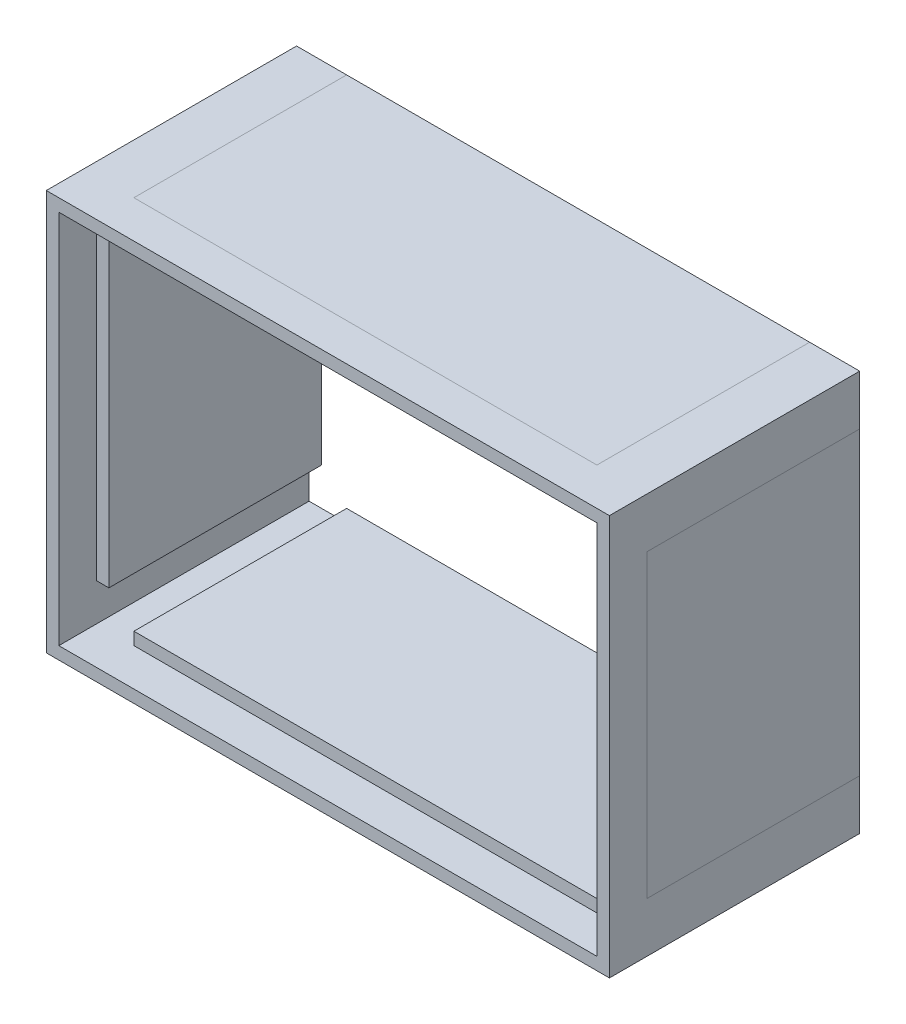
from build123d import *

# Parameters (mm, degrees)
SKETCH1_W               = 4500
SKETCH1_H               = 3200
SKETCH1_W_2             = 4300
SKETCH1_H_2             = 3000
BOSS_EXTRUDE1_DEPTH     = 2000
CUT_EXTRUDE1_DEPTH      = 5819.93461039
CUT_EXTRUDE1_DEPTH_BACK = 5819.93461039
SKETCH2_W               = 3700
SKETCH2_H               = 1700
CUT_EXTRUDE2_DEPTH      = 5873.81874401
CUT_EXTRUDE2_DEPTH_BACK = 5873.81874401
SKETCH3_W               = 1700
SKETCH3_H               = 2400
SKETCH4_W               = 3700
SKETCH4_H               = 200
BOSS_EXTRUDE2_DEPTH     = 1700
SKETCH4_W_2             = 200
SKETCH4_H_2             = 2400
BOSS_EXTRUDE2_2_DEPTH   = 1700
BOSS_EXTRUDE2_3_DEPTH   = 1700
BOSS_EXTRUDE2_4_DEPTH   = 1700


with BuildPart() as part:
    # Sketch1 → Boss-Extrude1 (new body)
    with BuildSketch(Plane.XY):
        with Locations((2250, 1600)):
            Rectangle(SKETCH1_W, SKETCH1_H)
        with Locations((2250, 1600)):
            Rectangle(SKETCH1_W_2, SKETCH1_H_2, mode=Mode.SUBTRACT)
    extrude(amount=BOSS_EXTRUDE1_DEPTH)

    # Sketch2 → Cut-Extrude1 (cut, two sides: drawn at the far end of the back side and taken through both)
    with BuildSketch(Plane.XZ.offset(-3100).offset(-CUT_EXTRUDE1_DEPTH_BACK)):
        with Locations((2250, 850)):
            Rectangle(SKETCH2_W, SKETCH2_H)
    extrude(amount=CUT_EXTRUDE1_DEPTH + CUT_EXTRUDE1_DEPTH_BACK, mode=Mode.SUBTRACT)

    # Sketch3 → Cut-Extrude2 (cut, two sides: drawn at the far end of the back side and taken through both)
    with BuildSketch(Plane.ZY.offset(-CUT_EXTRUDE2_DEPTH_BACK)):
        with Locations((850, 1600)):
            Rectangle(SKETCH3_W, SKETCH3_H)
    extrude(amount=CUT_EXTRUDE2_DEPTH + CUT_EXTRUDE2_DEPTH_BACK, mode=Mode.SUBTRACT)


with BuildPart() as body_2:
    # Sketch4 → Boss-Extrude2 (new body)
    with BuildSketch(Plane(origin=(0, 0, 1700), x_dir=(-1, 0, 0), z_dir=(0, 0, -1))):
        with Locations((-2250, 100)):
            Rectangle(SKETCH4_W, SKETCH4_H)
    extrude(amount=BOSS_EXTRUDE2_DEPTH)


with BuildPart() as body_3:
    # Sketch4 → Boss-Extrude2 2 (new body)
    with BuildSketch(Plane(origin=(0, 0, 1700), x_dir=(-1, 0, 0), z_dir=(0, 0, -1))):
        with Locations((-100, 1600)):
            Rectangle(SKETCH4_W_2, SKETCH4_H_2)
    extrude(amount=BOSS_EXTRUDE2_2_DEPTH)


with BuildPart() as body_4:
    # Sketch4 → Boss-Extrude2 3 (new body)
    with BuildSketch(Plane(origin=(0, 0, 1700), x_dir=(-1, 0, 0), z_dir=(0, 0, -1))):
        with Locations((-2250, 3100)):
            Rectangle(SKETCH4_W, SKETCH4_H)
    extrude(amount=BOSS_EXTRUDE2_3_DEPTH)


with BuildPart() as body_5:
    # Sketch4 → Boss-Extrude2 4 (new body)
    with BuildSketch(Plane(origin=(0, 0, 1700), x_dir=(-1, 0, 0), z_dir=(0, 0, -1))):
        with Locations((-4400, 1600)):
            Rectangle(SKETCH4_W_2, SKETCH4_H_2)
    extrude(amount=BOSS_EXTRUDE2_4_DEPTH)


solid = Compound([part.part, body_2.part, body_3.part, body_4.part, body_5.part])
